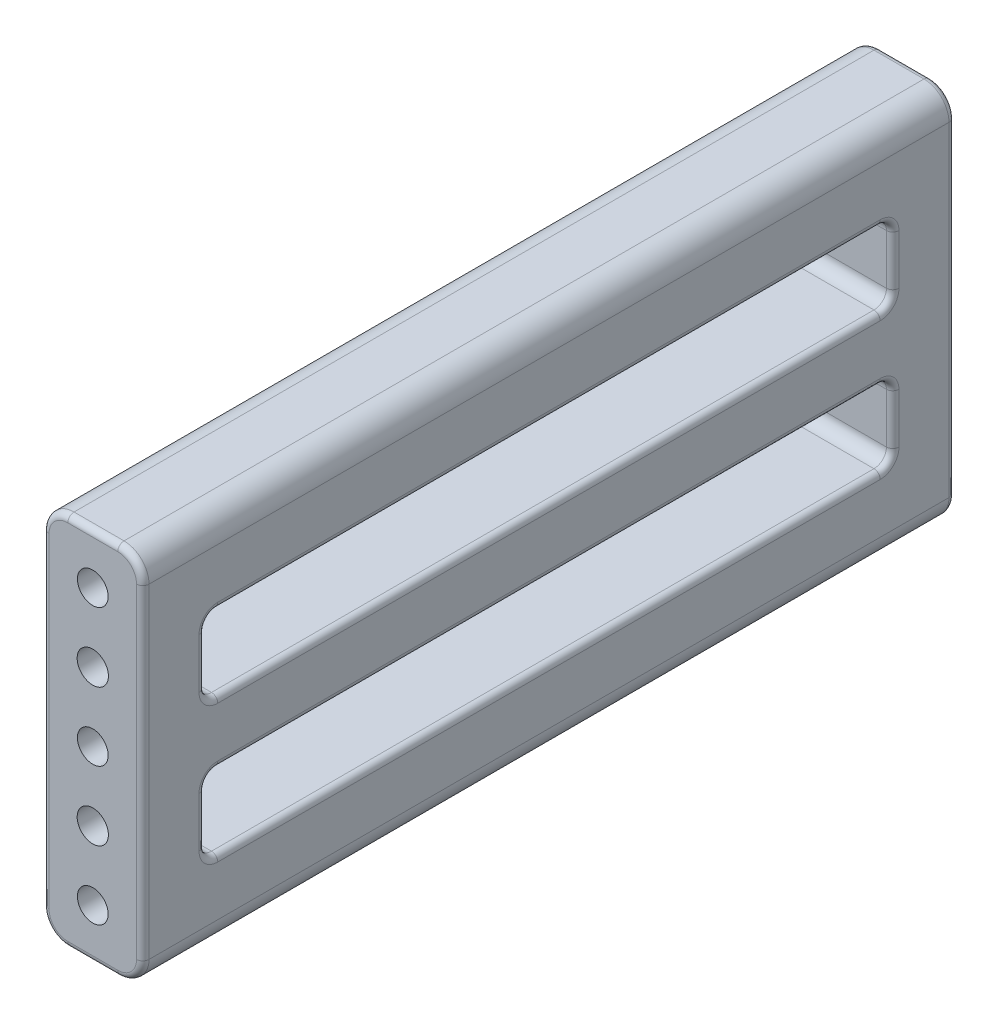
from build123d import *

# Parameters (mm, degrees)
SKETCH1_W                      = 65
SKETCH1_H                      = 30
BOSS_EXTRUDE1_DEPTH            = 8
FILLET1_R                      = 2
FILLET2_R                      = 0.5
SKETCH2_R                      = 1.2295
CUT_EXTRUDE1_DEPTH             = 10
SKETCH3_W                      = 55
SKETCH3_H                      = 6
CUT_EXTRUDE2_DEPTH             = 10
FILLET3_R                      = 1
FILLET4_R                      = 0.5
F_2_5MM_DOWEL_HOLE1_AT_2_COUNT = 2
F_2_5MM_DOWEL_HOLE1_AT_2_PITCH = 11


with BuildPart() as part:
    # Sketch1 → Boss-Extrude1 (new body)
    with BuildSketch(Plane(origin=(0, 0, 0), x_dir=(0, 0, -1), z_dir=(1, 0, 0))):
        Rectangle(SKETCH1_W, SKETCH1_H)
    extrude(amount=BOSS_EXTRUDE1_DEPTH)

    # Fillet1
    fillet1_edges = [part.edges().sort_by_distance(p)[0] for p in [
        (8, -15, 0),
        (0, -15, 0),
        (0, 15, 0),
        (8, 15, 0),
    ]]
    fillet(fillet1_edges, radius=FILLET1_R)

    # Fillet2
    fillet2_edges = [part.edges().sort_by_distance(p)[0] for p in [
        (8, 0, -32.5),
        (8, 0, 32.5),
        (0, 0, -32.5),
        (4, 15, -32.5),
        (4, -15, -32.5),
        (7.414213562, 14.414213562, -32.5),
        (0.585786438, 14.414213562, -32.5),
        (0.585786438, -14.414213562, -32.5),
        (7.414213562, -14.414213562, -32.5),
        (4, -15, 32.5),
        (0, 0, 32.5),
        (4, 15, 32.5),
        (7.414213562, 14.414213562, 32.5),
        (0.585786438, 14.414213562, 32.5),
        (0.585786438, -14.414213562, 32.5),
        (7.414213562, -14.414213562, 32.5),
    ]]
    fillet(fillet2_edges, radius=FILLET2_R)

    # Sketch2 → Cut-Extrude1 (cut)
    with BuildSketch(Plane(origin=(0, 0, -32.5), x_dir=(-1, 0, 0), z_dir=(0, 0, -1))):
        with Locations(Location((-4, 0, 0), (0, 0, 90))):
            Circle(SKETCH2_R)
        with Locations(Location((-4, 11, 0), (0, 0, 90))):
            Circle(SKETCH2_R)
        with Locations(Location((-4, -11, 0), (0, 0, 90))):
            Circle(SKETCH2_R)
    cut_extrude1 = extrude(amount=-CUT_EXTRUDE1_DEPTH, mode=Mode.SUBTRACT)

    # Sketch3 → Cut-Extrude2 (cut)
    with BuildSketch(Plane(origin=(8, 0, 0), x_dir=(0, 0, -1), z_dir=(1, 0, 0))):
        with Locations((0, 5.5)):
            Rectangle(SKETCH3_W, SKETCH3_H)
        with Locations((0, -5.5)):
            Rectangle(SKETCH3_W, SKETCH3_H)
    extrude(amount=-CUT_EXTRUDE2_DEPTH, mode=Mode.SUBTRACT)

    # Fillet3
    fillet3_edges = [part.edges().sort_by_distance(p)[0] for p in [
        (4, 2.5, 27.5),
        (4, 8.5, 27.5),
        (4, 8.5, -27.5),
        (4, 2.5, -27.5),
        (4, -8.5, 27.5),
        (4, -2.5, 27.5),
        (4, -2.5, -27.5),
        (4, -8.5, -27.5),
    ]]
    fillet(fillet3_edges, radius=FILLET3_R)

    # Fillet4
    fillet4_edges = [part.edges().sort_by_distance(p)[0] for p in [
        (8, -5.5, -27.5),
        (0, -5.5, -27.5),
        (8, -8.5, 0),
        (0, -8.5, 0),
        (8, -2.5, 0),
        (0, -2.5, 0),
        (8, -5.5, 27.5),
        (0, -5.5, 27.5),
        (8, 5.5, -27.5),
        (0, 5.5, -27.5),
        (8, 2.5, 0),
        (0, 2.5, 0),
        (8, 8.5, 0),
        (0, 8.5, 0),
        (8, 5.5, 27.5),
        (0, 5.5, 27.5),
        (8, -8.207106781, -27.207106781),
        (0, -8.207106781, -27.207106781),
        (8, -2.792893219, -27.207106781),
        (0, -2.792893219, -27.207106781),
        (8, -8.207106781, 27.207106781),
        (0, -8.207106781, 27.207106781),
        (8, -2.792893219, 27.207106781),
        (0, -2.792893219, 27.207106781),
        (8, 2.792893219, -27.207106781),
        (0, 2.792893219, -27.207106781),
        (8, 8.207106781, -27.207106781),
        (0, 8.207106781, -27.207106781),
        (8, 2.792893219, 27.207106781),
        (0, 2.792893219, 27.207106781),
        (8, 8.207106781, 27.207106781),
        (0, 8.207106781, 27.207106781),
    ]]
    fillet(fillet4_edges, radius=FILLET4_R)

    # Sketch6 → Ø2.5mm Dowel Hole1 (revolve, cut)
    with BuildSketch(Plane(origin=(4, 5.5, -32.5), x_dir=(0, 1, 0), z_dir=(1, 0, 0))):
        Polygon((0, 0), (0, 4.751075774), (1.25, 4), (1.25, 0), align=None)
    f_2_5mm_dowel_hole1 = revolve(axis=Axis((4, 5.5, -38.85), (0, 0, 1)), mode=Mode.SUBTRACT)

    # Ø2.5mm Dowel Hole1 at 2: Ø2.5mm Dowel Hole1 ×2
    with Locations(*[(0, -i * F_2_5MM_DOWEL_HOLE1_AT_2_PITCH, 0) for i in range(1, F_2_5MM_DOWEL_HOLE1_AT_2_COUNT)]):
        add(f_2_5mm_dowel_hole1, mode=Mode.SUBTRACT)

    # Mirror1: Cut-Extrude1, Ø2.5mm Dowel Hole1 across plane
    add(cut_extrude1.mirror(Plane.XY), mode=Mode.SUBTRACT)
    add(f_2_5mm_dowel_hole1.mirror(Plane.XY), mode=Mode.SUBTRACT)

    # Mirror1 copy 1 sketch → Mirror1 copy 1 (revolve, cut)
    with BuildSketch(Plane(origin=(4, -5.5, 32.5), x_dir=(0, 1, 0), z_dir=(1, 0, 0))):
        Polygon((0, 0), (0, -4.751075774), (1.25, -4), (1.25, 0), align=None)
    revolve(axis=Axis((4, -5.5, 38.85), (0, 0, 1)), mode=Mode.SUBTRACT)


solid = part.part
